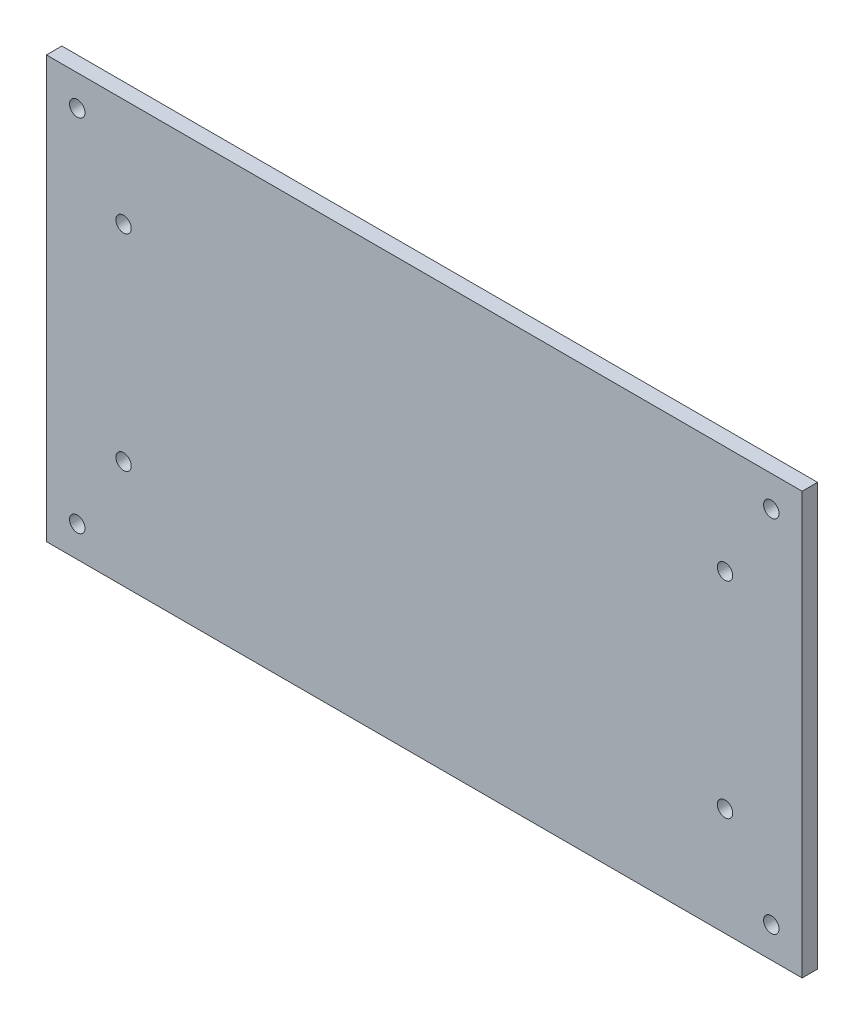
from build123d import *

# Parameters (mm, degrees)
SKETCH_1_W          = 147
SKETCH_1_H          = 82
SKETCH_1_R          = 1.5
EXTRUDE_1_DEPTH     = 3
SKETCH_2_R          = 1.5
CUT_EXTRUDE_1_DEPTH = 3


with BuildPart() as part:
    # 草图1 → 凸台-拉伸1 (new body)
    with BuildSketch(Plane.XY):
        with Locations((-3.474545455, -5.452727273)):
            Rectangle(SKETCH_1_W, SKETCH_1_H)
        with Locations((-70.974545455, 29.547272727)):
            Circle(SKETCH_1_R, mode=Mode.SUBTRACT)
        with Locations(Location((64.025454545, 29.547272727, 0), (0, 0, 180))):
            Circle(SKETCH_1_R, mode=Mode.SUBTRACT)
        with Locations((64.025454545, -40.452727273)):
            Circle(SKETCH_1_R, mode=Mode.SUBTRACT)
        with Locations(Location((-70.974545455, -40.452727273, 0), (0, 0, 180))):
            Circle(SKETCH_1_R, mode=Mode.SUBTRACT)
    extrude(amount=EXTRUDE_1_DEPTH)

    # 草图2 → 切除-拉伸1 (cut)
    with BuildSketch(Plane(origin=(0, 0, 0), x_dir=(-1, 0, 0), z_dir=(0, 0, -1))):
        with Locations((-55.025454545, 14.547272727)):
            Circle(SKETCH_2_R)
        with Locations((-55.025454545, -25.452727273)):
            Circle(SKETCH_2_R)
        with Locations((61.974545455, -25.452727273)):
            Circle(SKETCH_2_R)
        with Locations((61.974545455, 14.547272727)):
            Circle(SKETCH_2_R)
    extrude(amount=-CUT_EXTRUDE_1_DEPTH, mode=Mode.SUBTRACT)


solid = part.part
